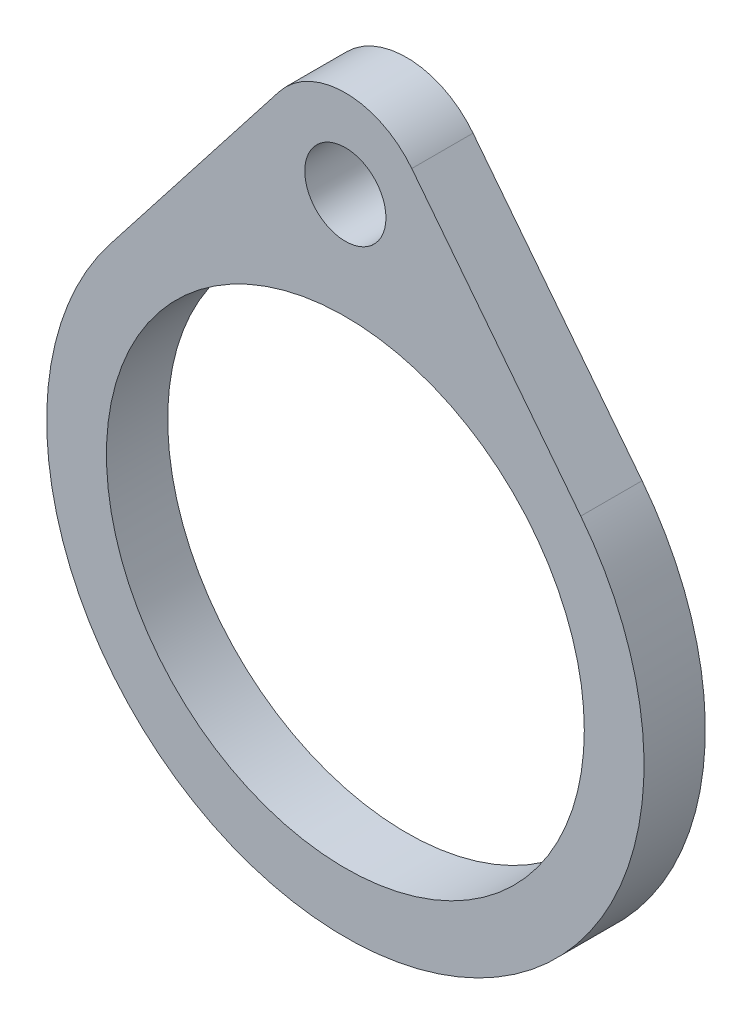
from build123d import *

# Parameters (mm, degrees)
SKETCH1_R           = 19.5
SKETCH1_R_2         = 15.6
BOSS_EXTRUDE1_DEPTH = 4
SKETCH3_R           = 2.65
BOSS_EXTRUDE2_DEPTH = 4


with BuildPart() as part:
    # Sketch1 → Boss-Extrude1 (new body)
    with BuildSketch(Plane.XY):
        Circle(SKETCH1_R)
        Circle(SKETCH1_R_2, mode=Mode.SUBTRACT)
    extrude(amount=BOSS_EXTRUDE1_DEPTH)

    # Sketch3 → Boss-Extrude2 (add)
    with BuildSketch(Plane.XY):
        with BuildLine():
            Line((-15.370426149, 12), (-4.335248401, 26.134615385))
            ThreePointArc((-4.335248401, 26.134615385), (0, 28.25), (4.335248401, 26.134615385))
            Line((4.335248401, 26.134615385), (15.370426149, 12))
            ThreePointArc((15.370426149, 12), (0, 19.5), (-15.370426149, 12))
        make_face()
        with Locations((0, 22.5)):
            Circle(SKETCH3_R, mode=Mode.SUBTRACT)
    extrude(amount=BOSS_EXTRUDE2_DEPTH)


solid = part.part
